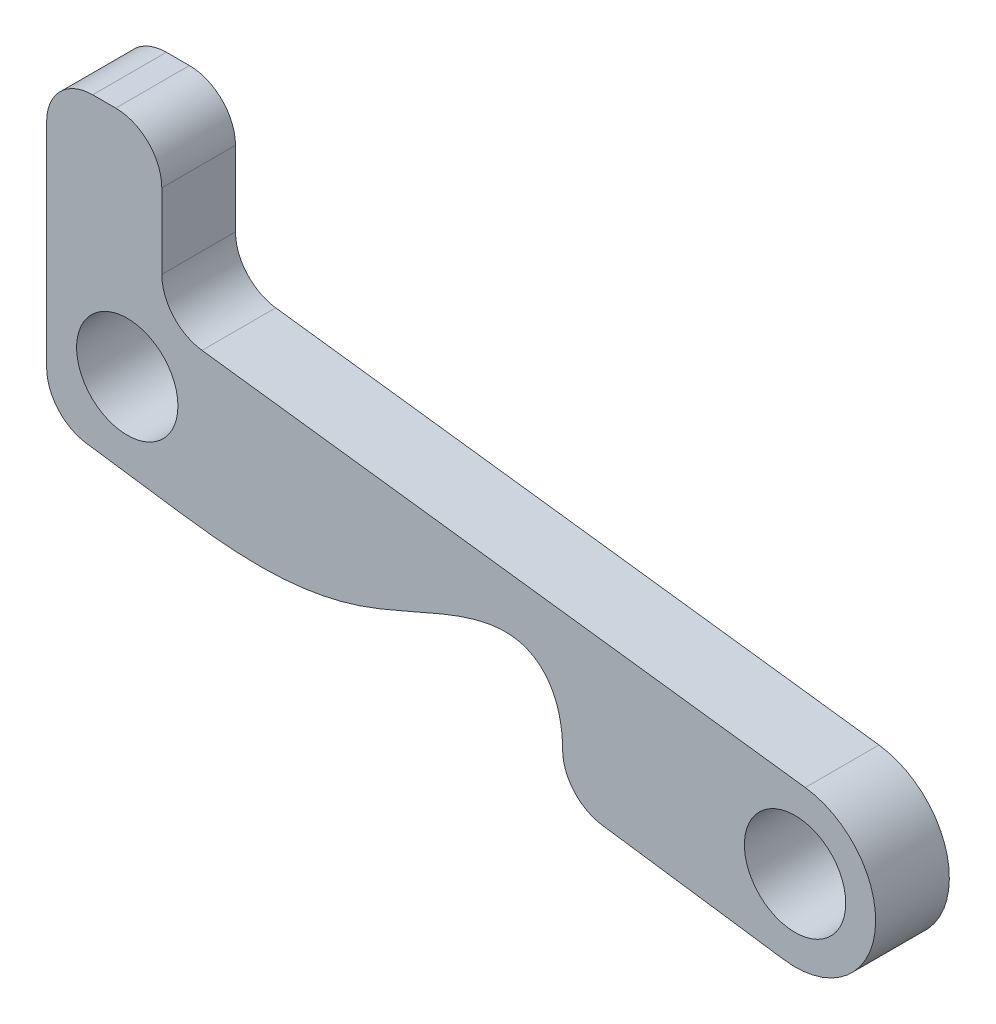
from build123d import *

# Parameters (mm, degrees)
SKETCH1_R           = 1.1
BOSS_EXTRUDE1_DEPTH = 0.8
FILLET1_R           = 1


with BuildPart() as part:
    # Sketch1 → Boss-Extrude1 (new, symmetric)
    with BuildSketch(Plane.XY):
        with BuildLine():
            Line((0.75, 1.418659837), (14.721500475, -0.364074443))
            ThreePointArc((14.721500475, -0.364074443), (16.234415683, -2.333028406), (14.255453949, -3.832829256))
            Line((14.255453949, -3.832829256), (12.712907233, -3.615136886))
            Line((12.712907233, -3.615136886), (10.312842352, -3.276427006))
            ThreePointArc((10.312842352, -3.276427006), (9.698394701, -2.942897128), (9.452585289, -2.288400506))
            add(Edge.make_bspline(
                [(9.452585289, -2.288400506), (9.450870019, -1.494900378), (8.489042718, 0.058923345), (4.930908227, -2.300819074), (2.487654104, -2.172094957), (1.138622907, -1.981712523)],
                knots=[0.051353436, 0.051353436, 0.051353436, 0.051353436, 0.215328782, 0.591995085, 1, 1, 1, 1], degree=3))
            Line((1.138622907, -1.981712523), (-1.75, -1.574054745))
            Line((-1.75, -1.574054745), (-1.75, 4.925945255))
            Line((-1.75, 4.925945255), (0.75, 4.925945255))
            Line((0.75, 4.925945255), (0.75, 1.418659837))
        make_face()
        with Locations((14.5, -2.1)):
            Circle(SKETCH1_R, mode=Mode.SUBTRACT)
        Circle(SKETCH1_R, mode=Mode.SUBTRACT)
    extrude(amount=BOSS_EXTRUDE1_DEPTH, both=True)

    # Fillet1
    fillet1_edges = [part.edges().sort_by_distance(p)[0] for p in [
        (0.75, 1.418659837, 0),
        (-1.75, -1.574054745, 0),
        (-1.75, 4.925945255, 0),
        (0.75, 4.925945255, 0),
    ]]
    fillet(fillet1_edges, radius=FILLET1_R)


solid = part.part
